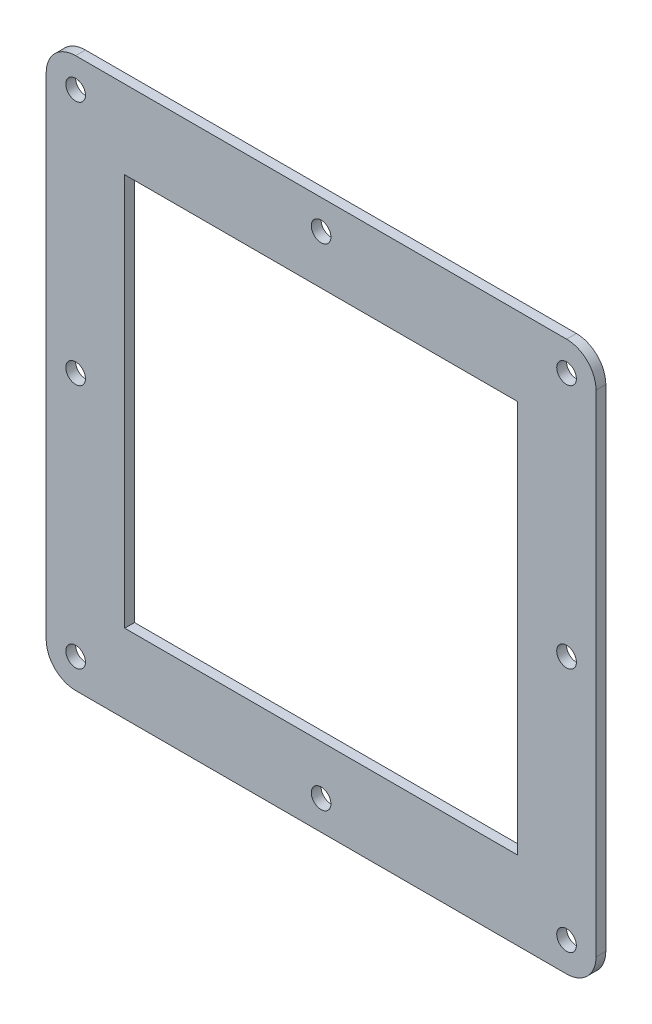
from build123d import *

# Parameters (mm, degrees)
SKETCH2_R           = 5
SKETCH2_R_2         = 4
BOSS_EXTRUDE1_DEPTH = 5
SKETCH3_W           = 200
SKETCH3_H           = 200
CUT_EXTRUDE1_DEPTH  = 10


with BuildPart() as part:
    # Sketch2 → Boss-Extrude1 (new body)
    with BuildSketch(Plane.XY):
        with BuildLine():
            Line((-125, 140), (125, 140))
            ThreePointArc((125, 140), (135.606601718, 135.606601718), (140, 125))
            Line((140, 125), (140, -125))
            ThreePointArc((140, -125), (135.606601718, -135.606601718), (125, -140))
            Line((125, -140), (-125, -140))
            ThreePointArc((-125, -140), (-135.606601718, -135.606601718), (-140, -125))
            Line((-140, -125), (-140, 125))
            ThreePointArc((-140, 125), (-135.606601718, 135.606601718), (-125, 140))
        make_face()
        with Locations((-125, 125)):
            Circle(SKETCH2_R, mode=Mode.SUBTRACT)
        with Locations((0, 125)):
            Circle(SKETCH2_R, mode=Mode.SUBTRACT)
        with Locations((125, 125)):
            Circle(SKETCH2_R, mode=Mode.SUBTRACT)
        Circle(SKETCH2_R_2, mode=Mode.SUBTRACT)
        with Locations((125, 0)):
            Circle(SKETCH2_R, mode=Mode.SUBTRACT)
        with Locations((-125, 0)):
            Circle(SKETCH2_R, mode=Mode.SUBTRACT)
        with Locations((-125, -125)):
            Circle(SKETCH2_R, mode=Mode.SUBTRACT)
        with Locations((0, -125)):
            Circle(SKETCH2_R, mode=Mode.SUBTRACT)
        with Locations((125, -125)):
            Circle(SKETCH2_R, mode=Mode.SUBTRACT)
    extrude(amount=BOSS_EXTRUDE1_DEPTH)

    # Sketch3 → Cut-Extrude1 (cut)
    with BuildSketch(Plane.XY.offset(5)):
        Rectangle(SKETCH3_W, SKETCH3_H)
    extrude(amount=-CUT_EXTRUDE1_DEPTH, mode=Mode.SUBTRACT)


solid = part.part
